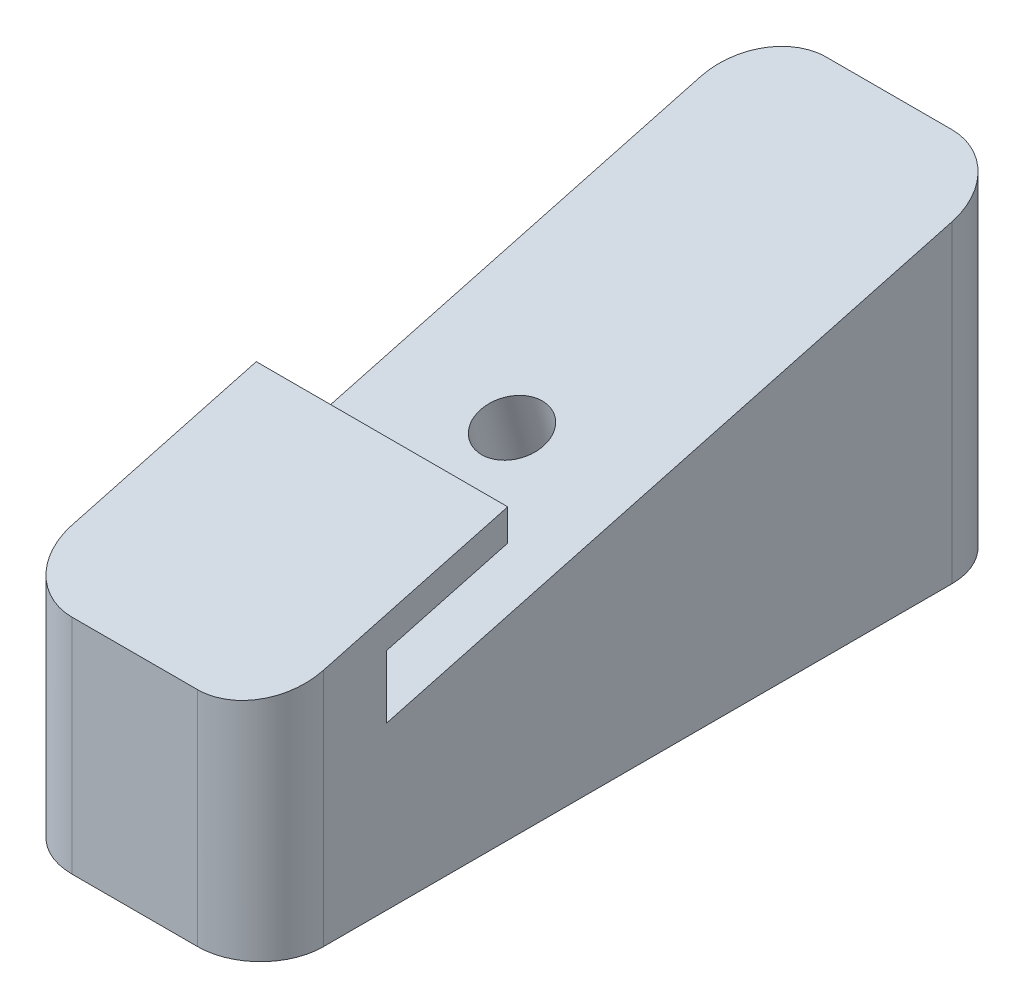
from build123d import *

# Parameters (mm, degrees)
SKETCH1_W               = 25.4
SKETCH1_H               = 76.2
BOSS_EXTRUDE1_DEPTH     = 33.3756
CUT_EXTRUDE2_DEPTH      = 57.663045059
CUT_EXTRUDE2_DEPTH_BACK = 57.663045059
SKETCH5_R               = 3.175
CUT_EXTRUDE3_DEPTH      = 6.35
BOSS_EXTRUDE2_REACH     = 63.744
SKETCH1_5_W             = 25.4
SKETCH1_5_H             = 12.7
SKETCH7_W               = 25.4
SKETCH7_H               = 3.175
BOSS_EXTRUDE3_DEPTH     = 12.7
FILLET1_R               = 6.35


with BuildPart() as part:
    # Sketch1 → Boss-Extrude1 (new body)
    with BuildSketch(Plane(origin=(0, 0, 0), x_dir=(1, 0, 0), z_dir=(0, 1, 0))):
        Rectangle(SKETCH1_W, SKETCH1_H)
    extrude(amount=BOSS_EXTRUDE1_DEPTH)

    # Sketch4 → Cut-Extrude2 (cut, two sides: drawn at the far end of the back side and taken through both)
    with BuildSketch(Plane(origin=(12.7, 0, 0), x_dir=(0, 0, -1), z_dir=(1, 0, 0)).offset(-CUT_EXTRUDE2_DEPTH_BACK)):
        Polygon((38.1, 33.3756), (-38.1, 33.3756), (-38.1, 12.957871537), align=None)
    extrude(amount=CUT_EXTRUDE2_DEPTH + CUT_EXTRUDE2_DEPTH_BACK, mode=Mode.SUBTRACT)

    # Sketch5 → Cut-Extrude3 (cut)
    with BuildSketch(Plane(origin=(0, 21.614858733, 5.791683942), x_dir=(1, 0, 0), z_dir=(0, 0.9659258262890681, 0.2588190451025215))):
        with Locations((0, 5.99599243)):
            Circle(SKETCH5_R)
    extrude(amount=-CUT_EXTRUDE3_DEPTH, mode=Mode.SUBTRACT)

    # Boss-Extrude2: from a plane face, 63.744 long prism both ways, kept between that surface and its translate by the depth
    boss_extrude2_start = Plane(origin=(-12.7, 12.957871537, 38.1), z_dir=(0, -0.9659258262890681, -0.2588190451025217)) * Box(256.976, 256.976, 128.488, align=(Align.CENTER, Align.CENTER, Align.MIN), mode=Mode.PRIVATE)
    boss_extrude2_end = Plane(origin=(-12.7, 22.482871537, 38.1), z_dir=(0, -0.9659258262890681, -0.2588190451025217)) * Box(256.976, 256.976, 128.488, align=(Align.CENTER, Align.CENTER, Align.MIN), mode=Mode.PRIVATE)
    # Sketch1<5> → Boss-Extrude2 (add, from a surface)
    with BuildSketch(Plane(origin=(0, 0, 0), x_dir=(1, 0, 0), z_dir=(0, 1, 0)), mode=Mode.PRIVATE) as boss_extrude2_sk1:
        with Locations((0, -31.75)):
            Rectangle(SKETCH1_5_W, SKETCH1_5_H)
    boss_extrude2_tool1 = extrude(boss_extrude2_sk1.sketch, amount=BOSS_EXTRUDE2_REACH, both=True, mode=Mode.PRIVATE)
    add(((boss_extrude2_tool1 - boss_extrude2_start) & boss_extrude2_end).solids().sort_by_distance((0, 22.344985, 3.066814))[0])

    # Sketch7 → Boss-Extrude3 (add, along a direction that is not the sketch's normal)
    with BuildSketch(Plane(origin=(0, 0, 25.4), x_dir=(-1, 0, 0), z_dir=(0, 0, -1))):
        with Locations((0, 24.298326281)):
            Rectangle(SKETCH7_W, SKETCH7_H)
    extrude(amount=BOSS_EXTRUDE3_DEPTH, dir=(0, 0.2588190451025216, -0.965925826289068))

    # Fillet1
    fillet1_edges = [part.edges().sort_by_distance(p)[0] for p in [
        (-12.7, 16.6878, -38.1),
        (-12.7, 11.241435768, 38.1),
        (12.7, 16.6878, -38.1),
        (12.7, 11.241435768, 38.1),
    ]]
    fillet(fillet1_edges, radius=FILLET1_R)


solid = part.part
